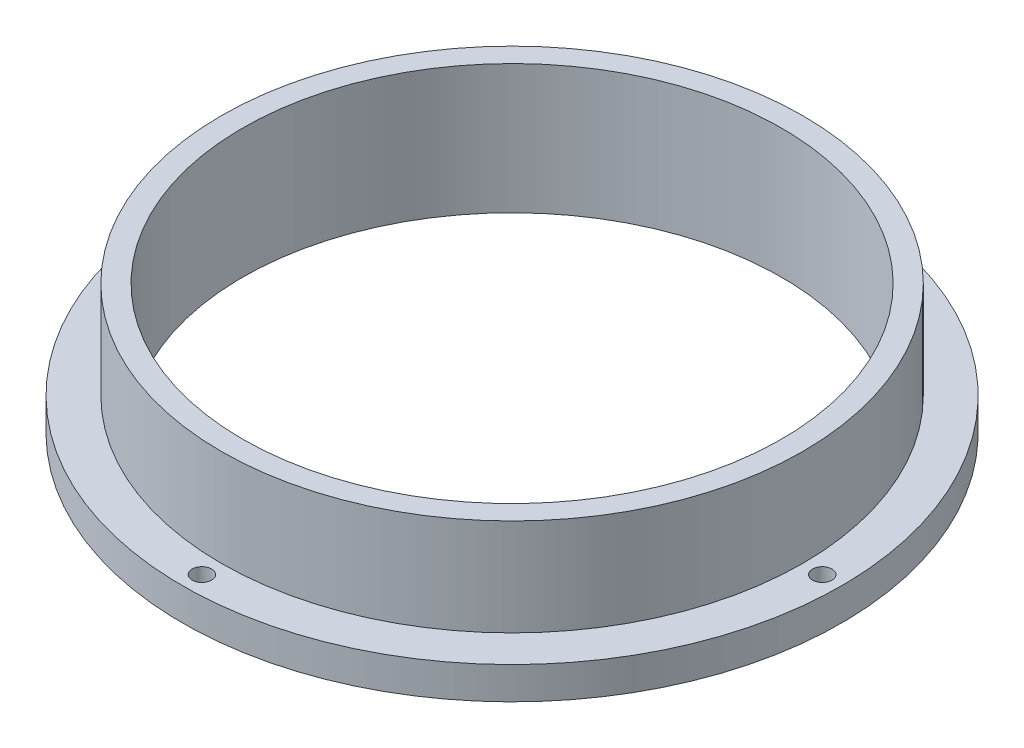
from build123d import *

# Parameters (mm, degrees)
SKETCH1_R           = 45
SKETCH1_R_2         = 42
BOSS_EXTRUDE1_DEPTH = 20
SKETCH2_R           = 51
SKETCH2_R_2         = 1.5
SKETCH2_R_3         = 45
BOSS_EXTRUDE2_DEPTH = 5
BOSS_EXTRUDE3_START = -20
SKETCH3_R           = 42
SKETCH3_R_2         = 41.5
BOSS_EXTRUDE3_DEPTH = 20
SKETCH4_R           = 41.7
SKETCH4_R_2         = 41.5
CUT_EXTRUDE1_DEPTH  = 75.846509605


with BuildPart() as part:
    # Sketch1 → Boss-Extrude1 (new body)
    with BuildSketch(Plane(origin=(0, 0, 0), x_dir=(1, 0, 0), z_dir=(0, 1, 0))):
        with Locations(Location((0, 0, 0), (0, 0, 270))):
            Circle(SKETCH1_R)
        with Locations(Location((0, 0, 0), (0, 0, 270))):
            Circle(SKETCH1_R_2, mode=Mode.SUBTRACT)
    extrude(amount=BOSS_EXTRUDE1_DEPTH)

    # Sketch2 → Boss-Extrude2 (add)
    with BuildSketch(Plane.XZ):
        with Locations(Location((0, 0, 0), (0, 0, 270))):
            Circle(SKETCH2_R)
        with Locations(Location((0, -48, 0), (0, 0, 270))):
            Circle(SKETCH2_R_2, mode=Mode.SUBTRACT)
        with Locations(Location((-48, 0, 0), (0, 0, 270))):
            Circle(SKETCH2_R_2, mode=Mode.SUBTRACT)
        with Locations(Location((0, 0, 0), (0, 0, 270))):
            Circle(SKETCH2_R_3, mode=Mode.SUBTRACT)
        with BuildLine():
            ThreePointArc((49.5, 0), (48, -1.5), (46.5, 0))
            ThreePointArc((46.5, 0), (48, 1.5), (49.5, 0))
        make_face(mode=Mode.SUBTRACT)
        with Locations(Location((0, 48, 0), (0, 0, 270))):
            Circle(SKETCH2_R_2, mode=Mode.SUBTRACT)
    extrude(amount=-BOSS_EXTRUDE2_DEPTH)

    # Sketch3 → Boss-Extrude3 (add)
    with BuildSketch(Plane(origin=(0, 20, 0), x_dir=(1, 0, 0), z_dir=(0, 1, 0)).offset(BOSS_EXTRUDE3_START)):
        Circle(SKETCH3_R)
        with Locations(Location((0, 0, 0), (0, 0, 270))):
            Circle(SKETCH3_R_2, mode=Mode.SUBTRACT)
    extrude(amount=BOSS_EXTRUDE3_DEPTH)

    # Sketch4 → Cut-Extrude1 (cut, through all)
    with BuildSketch(Plane(origin=(0, 20, 0), x_dir=(1, 0, 0), z_dir=(0, 1, 0))):
        with Locations(Location((0, 0, 0), (0, 0, 270))):
            Circle(SKETCH4_R)
        Circle(SKETCH4_R_2, mode=Mode.SUBTRACT)
    extrude(amount=-CUT_EXTRUDE1_DEPTH, mode=Mode.SUBTRACT)


solid = part.part
